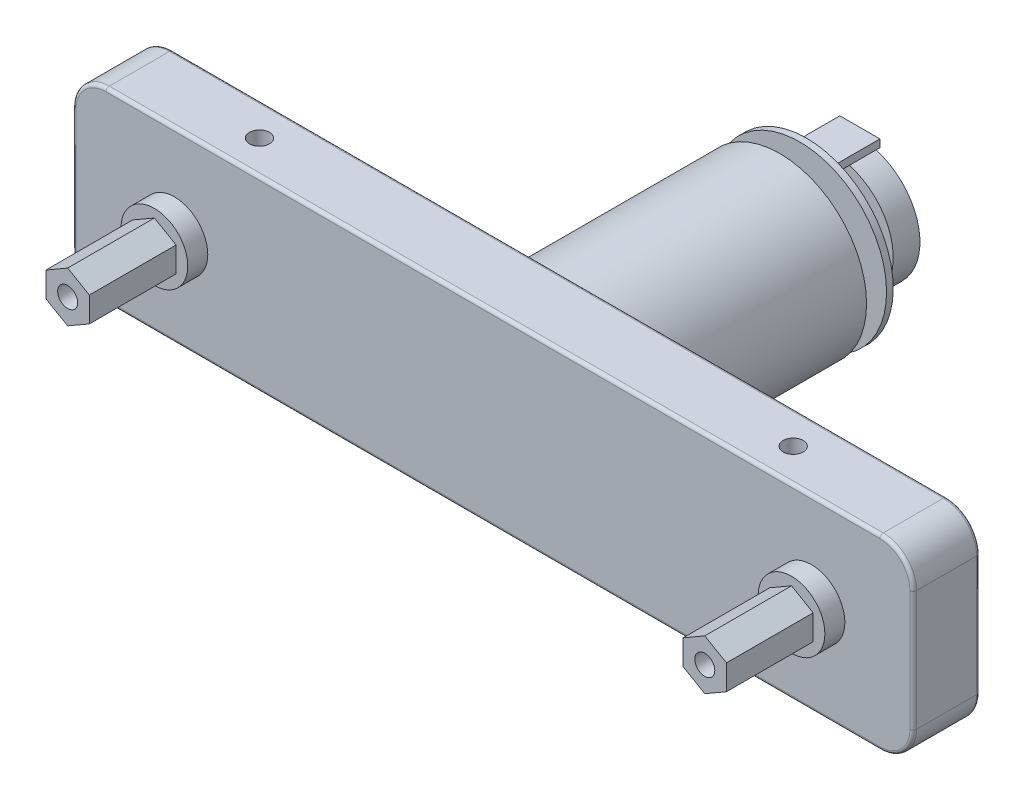
from build123d import *

# Parameters (mm, degrees)
SKETCH_1_W          = 126
SKETCH_1_H          = 28
EXTRUDE_1_DEPTH     = 5
FILLET_1_R          = 5
FILLET_2_R          = 0.5
SKETCH_3_R          = 1.5
CUT_EXTRUDE_1_DEPTH = 10
SKETCH_4_R          = 5
EXTRUDE_2_DEPTH     = 3
EXTRUDE_3_DEPTH     = 13
SKETCH_6_R          = 1.5
CUT_EXTRUDE_2_DEPTH = 6
SKETCH_7_R          = 13
EXTRUDE_4_DEPTH     = 33
SKETCH_8_R          = 5
EXTRUDE_5_DEPTH     = 3
SKETCH_9_R          = 13
EXTRUDE_6_DEPTH     = 1
SKETCH_10_R         = 1
EXTRUDE_7_DEPTH     = 4
SKETCH_11_R         = 9
EXTRUDE_8_DEPTH     = 4
SKETCH_12_W         = 6
SKETCH_12_H         = 1.146117225
EXTRUDE_9_DEPTH     = 8
SKETCH_13_W         = 13
SKETCH_13_H         = 5
EXTRUDE_10_DEPTH    = 3.9


with BuildPart() as part:
    # 草图1 → 凸台-拉伸1 (new, symmetric)
    with BuildSketch(Plane.XY):
        Rectangle(SKETCH_1_W, SKETCH_1_H)
    extrude(amount=EXTRUDE_1_DEPTH, both=True)

    # 圆角1
    fillet_1_edges = [part.edges().sort_by_distance(p)[0] for p in [
        (63, -14, 0),
        (-63, -14, 0),
        (-63, 14, 0),
        (63, 14, 0),
    ]]
    fillet(fillet_1_edges, radius=FILLET_1_R)

    # 圆角2
    fillet_2_edges = [part.edges().sort_by_distance(p)[0] for p in [
        (0, -14, -5),
        (0, -14, 5),
        (63, 0, -5),
        (-63, 0, -5),
        (0, 14, -5),
        (61.535533906, 12.535533906, -5),
        (61.535533906, -12.535533906, -5),
        (-61.535533906, 12.535533906, -5),
        (-61.535533906, -12.535533906, -5),
        (-63, 0, 5),
        (63, 0, 5),
        (0, 14, 5),
        (61.535533906, 12.535533906, 5),
        (61.535533906, -12.535533906, 5),
        (-61.535533906, 12.535533906, 5),
        (-61.535533906, -12.535533906, 5),
    ]]
    fillet(fillet_2_edges, radius=FILLET_2_R)

    # 草图3 → 切除-拉伸1 (cut)
    with BuildSketch(Plane.XZ.offset(14)):
        with Locations(Location((-40, 0, 0), (0, 0, 270))):
            Circle(SKETCH_3_R)
        with Locations(Location((40, 0, 0), (0, 0, 90))):
            Circle(SKETCH_3_R)
    cut_extrude_1 = extrude(amount=-CUT_EXTRUDE_1_DEPTH, mode=Mode.SUBTRACT)

    # 草图4 → 凸台-拉伸2 (add)
    with BuildSketch(Plane.XY.offset(5)):
        with Locations((47.75, 0)):
            Circle(SKETCH_4_R)
    extrude_2 = extrude(amount=EXTRUDE_2_DEPTH)

    # 草图5 → 凸台-拉伸3 (add)
    with BuildSketch(Plane.XY.offset(8)):
        Polygon((47.75, -3.75277675), (51, -1.876388375), (51, 1.876388375), (47.75, 3.75277675), (44.5, 1.876388375), (44.5, -1.876388375), align=None)
    extrude_3 = extrude(amount=EXTRUDE_3_DEPTH)

    # 草图6 → 切除-拉伸2 (cut)
    with BuildSketch(Plane.XY.offset(21)):
        with Locations((47.75, 0)):
            Circle(SKETCH_6_R)
    cut_extrude_2 = extrude(amount=-CUT_EXTRUDE_2_DEPTH, mode=Mode.SUBTRACT)

    # 镜向1: 凸台-拉伸2, 凸台-拉伸3, 切除-拉伸2 across plane
    add(extrude_2.mirror(Plane(origin=(0, 0, 0), x_dir=(0, 0, 1), z_dir=(1, 0, 0))))
    add(extrude_3.mirror(Plane(origin=(0, 0, 0), x_dir=(0, 0, 1), z_dir=(1, 0, 0))))
    add(cut_extrude_2.mirror(Plane(origin=(0, 0, 0), x_dir=(0, 0, 1), z_dir=(1, 0, 0))), mode=Mode.SUBTRACT)

    # 草图7 → 凸台-拉伸4 (add)
    with BuildSketch(Plane(origin=(0, 0, -5), x_dir=(-1, 0, 0), z_dir=(0, 0, -1))):
        with Locations(Location((0, 0, 0), (0, 0, 180))):
            Circle(SKETCH_7_R)
    extrude(amount=EXTRUDE_4_DEPTH)

    # 草图8 → 凸台-拉伸5 (add)
    with BuildSketch(Plane(origin=(0, 0, -38), x_dir=(-1, 0, 0), z_dir=(0, 0, -1))):
        Circle(SKETCH_8_R)
    extrude(amount=EXTRUDE_5_DEPTH)

    # 草图9 → 凸台-拉伸6 (add)
    with BuildSketch(Plane(origin=(0, 0, -41), x_dir=(-1, 0, 0), z_dir=(0, 0, -1))):
        with Locations(Location((0, 0, 0), (0, 0, 180))):
            Circle(SKETCH_9_R)
    extrude(amount=EXTRUDE_6_DEPTH)

    # 草图10 → 凸台-拉伸7 (add)
    with BuildSketch(Plane(origin=(0, 0, -42), x_dir=(-1, 0, 0), z_dir=(0, 0, -1))):
        Circle(SKETCH_10_R)
    extrude(amount=EXTRUDE_7_DEPTH)

    # 草图11 → 凸台-拉伸8 (add)
    with BuildSketch(Plane(origin=(0, 0, -46), x_dir=(-1, 0, 0), z_dir=(0, 0, -1))):
        Circle(SKETCH_11_R)
    extrude(amount=EXTRUDE_8_DEPTH)

    # 草图12 → 凸台-拉伸9 (add)
    with BuildSketch(Plane(origin=(0, 0, -42), x_dir=(-1, 0, 0), z_dir=(0, 0, -1))):
        with Locations((0, 9.822897289)):
            Rectangle(SKETCH_12_W, SKETCH_12_H)
    extrude(amount=EXTRUDE_9_DEPTH)

    # 草图13 → 凸台-拉伸10 (add)
    with BuildSketch(Plane(origin=(0, 0, -42), x_dir=(-1, 0, 0), z_dir=(0, 0, -1))):
        with Locations((0.124599067, -8.685467679)):
            Rectangle(SKETCH_13_W, SKETCH_13_H)
    extrude(amount=EXTRUDE_10_DEPTH)

    # 镜向2: 切除-拉伸1 across plane
    add(cut_extrude_1.mirror(Plane.ZX), mode=Mode.SUBTRACT)


solid = part.part
